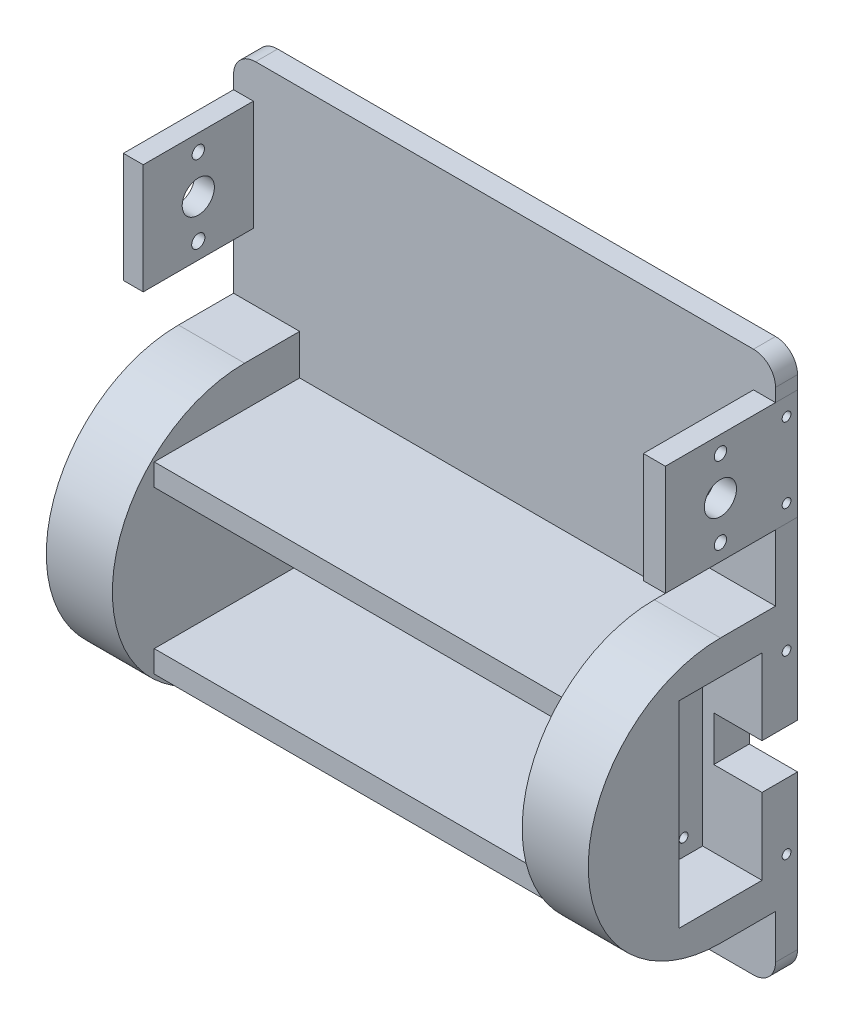
from build123d import *

# Parameters (mm, degrees)
RESSALTO_EXTRUS_O1_DEPTH      = 5
ESBO_O4_W                     = 4.495494134
ESBO_O4_H                     = 25
CORTE_EXTRUS_O2_DEPTH         = 5
RESSALTO_EXTRUS_O2_DEPTH      = 25
RESSALTO_EXTRUS_O2_DEPTH_BACK = 5
ESBO_O5_W                     = 4.495494134
ESBO_O5_H                     = 25
ESBO_O6_R                     = 1
CORTE_EXTRUS_O3_DEPTH         = 10
ESBO_O7_R                     = 1
CORTE_EXTRUS_O4_DEPTH         = 10
ESBO_O8_R                     = 3.65
CORTE_EXTRUS_O5_DEPTH         = 10
ESBO_O9_R                     = 1.4
CORTE_EXTRUS_O6_DEPTH         = 10
ESBO_O10_R                    = 1.5
CORTE_EXTRUS_O7_DEPTH         = 10
ESBO_O11_W                    = 5
ESBO_O11_H                    = 25
CORTE_EXTRUS_O8_DEPTH         = 10
RESSALTO_EXTRUS_O3_DEPTH      = 25
RESSALTO_EXTRUS_O3_DEPTH_BACK = 5
ESBO_O16_W                    = 5
ESBO_O16_H                    = 25
CORTE_EXTRUS_O9_START         = -10
ESBO_O17_R                    = 1
CORTE_EXTRUS_O9_DEPTH         = 10
CORTE_EXTRUS_O10_START        = -10
ESBO_O18_R                    = 1
CORTE_EXTRUS_O10_DEPTH        = 10
ESBO_O20_R                    = 3.65
CORTE_EXTRUS_O11_DEPTH        = 6
ESBO_O22_R                    = 1.4
CORTE_EXTRUS_O12_DEPTH        = 5
ESBO_O23_R                    = 1.4
CORTE_EXTRUS_O13_DEPTH        = 5
ESBO_O24_W                    = 15
ESBO_O24_H                    = 60
CORTE_EXTRUS_O14_DEPTH        = 10
ESBO_O27_W                    = 15
ESBO_O27_H                    = 60
CORTE_EXTRUS_O16_DEPTH        = 25
RESSALTO_EXTRUS_O7_DEPTH      = 12.5
RESSALTO_EXTRUS_O7_DEPTH_BACK = 5
ESBO_O32_W                    = 15
ESBO_O32_H                    = 60
RESSALTO_EXTRUS_O8_DEPTH      = 15
RESSALTO_EXTRUS_O9_DEPTH      = 12.5
RESSALTO_EXTRUS_O9_DEPTH_BACK = 5
ESBO_O34_W                    = 15
ESBO_O34_H                    = 60
RESSALTO_EXTRUS_O10_DEPTH     = 15
ESBO_O36_R                    = 1
CORTE_EXTRUS_O18_DEPTH        = 20
CORTE_EXTRUS_O19_START        = -20
ESBO_O37_R                    = 1
CORTE_EXTRUS_O19_DEPTH        = 20
ESBO_O39_W                    = 18.85
ESBO_O39_H                    = 44.705
CORTE_EXTRUS_O20_DEPTH        = 13.49
ESBO_O43_W                    = 10.95
ESBO_O43_H                    = 10.16
CORTE_EXTRUS_O23_DEPTH        = 10
ESBO_O44_W                    = 33
ESBO_O44_H                    = 5
RESSALTO_EXTRUS_O11_DEPTH     = 93
ESBO_O47_W                    = 33
ESBO_O47_H                    = 5
RESSALTO_EXTRUS_O12_DEPTH     = 93
ESBO_O41_R                    = 1.6255
ESBO_O41_R_2                  = 1
CORTE_EXTRUS_O25_DEPTH        = 31
ESBO_O42_R                    = 1.6255
ESBO_O42_R_2                  = 1
CORTE_EXTRUS_O26_DEPTH        = 31
ESBO_O52_W                    = 18.85
ESBO_O52_H                    = 44.705
CORTE_EXTRUS_O27_DEPTH        = 13.49
ESBO_O54_W                    = 10.951
ESBO_O54_H                    = 10.16
CORTE_EXTRUS_O28_DEPTH        = 24
ESBO_O55_R                    = 1.6255
ESBO_O55_R_2                  = 1
CORTE_EXTRUS_O29_DEPTH        = 31


with BuildPart() as part:
    # Esboço1 → Ressalto-extrusão1 (new body)
    with BuildSketch(Plane.XY):
        with BuildLine():
            Line((-47.810925728, 58.485502959), (65.189074272, 58.485502959))
            ThreePointArc((65.189074272, 58.485502959), (68.724608178, 57.021036865), (70.189074272, 53.485502959))
            Line((70.189074272, 53.485502959), (70.189074272, -59.514497041))
            ThreePointArc((70.189074272, -59.514497041), (68.724608178, -63.050030947), (65.189074272, -64.514497041))
            Line((65.189074272, -64.514497041), (-47.810925728, -64.514497041))
            ThreePointArc((-47.810925728, -64.514497041), (-51.346459634, -63.050030947), (-52.810925728, -59.514497041))
            Line((-52.810925728, -59.514497041), (-52.810925728, 53.485502959))
            ThreePointArc((-52.810925728, 53.485502959), (-51.346459634, 57.021036865), (-47.810925728, 58.485502959))
        make_face()
    extrude(amount=RESSALTO_EXTRUS_O1_DEPTH)

    # Esboço4 → Corte-extrusão2 (cut)
    with BuildSketch(Plane.XY.offset(5)):
        with Locations((-50.563178661, 37.985502959)):
            Rectangle(ESBO_O4_W, ESBO_O4_H)
    extrude(amount=-CORTE_EXTRUS_O2_DEPTH, mode=Mode.SUBTRACT)


with BuildPart() as body_2:
    # Esboço5 → Ressalto-extrusão2 (new, two sides: drawn at the far end of the back side and taken through both)
    with BuildSketch(Plane.XY.offset(5).offset(-RESSALTO_EXTRUS_O2_DEPTH_BACK)):
        with Locations((-50.563178661, 37.985502959)):
            Rectangle(ESBO_O5_W, ESBO_O5_H)
    extrude(amount=RESSALTO_EXTRUS_O2_DEPTH + RESSALTO_EXTRUS_O2_DEPTH_BACK)


with BuildPart() as corte_extrus_o3_tool:
    # Esboço6 → Corte-extrusão3 (new body)
    with BuildSketch(Plane.ZY.offset(52.810925728)):
        with Locations((2.5, 46.485502959)):
            Circle(ESBO_O6_R)
    extrude(amount=-CORTE_EXTRUS_O3_DEPTH)


with BuildPart() as part_1:
    add(part.part)

    # Corte-extrusão3: cut by corte_extrus_o3_tool
    add(corte_extrus_o3_tool.part, mode=Mode.SUBTRACT)


with BuildPart() as body_2_1:
    add(body_2.part)

    # Corte-extrusão3: cut by corte_extrus_o3_tool
    add(corte_extrus_o3_tool.part, mode=Mode.SUBTRACT)


with BuildPart() as corte_extrus_o4_tool:
    # Esboço7 → Corte-extrusão4 (new body)
    with BuildSketch(Plane.ZY.offset(52.810925728)):
        with Locations((2.5, 29.485502959)):
            Circle(ESBO_O7_R)
    extrude(amount=-CORTE_EXTRUS_O4_DEPTH)


with BuildPart() as part_2:
    add(part_1.part)

    # Corte-extrusão4: cut by corte_extrus_o4_tool
    add(corte_extrus_o4_tool.part, mode=Mode.SUBTRACT)

    # Esboço11 → Corte-extrusão8 (cut)
    with BuildSketch(Plane.XY.offset(5)):
        with Locations((67.689074272, 37.985502959)):
            Rectangle(ESBO_O11_W, ESBO_O11_H)
    extrude(amount=-CORTE_EXTRUS_O8_DEPTH, mode=Mode.SUBTRACT)


with BuildPart() as body_2_2:
    add(body_2_1.part)

    # Corte-extrusão4: cut by corte_extrus_o4_tool
    add(corte_extrus_o4_tool.part, mode=Mode.SUBTRACT)

    # Esboço8 → Corte-extrusão5 (cut)
    with BuildSketch(Plane(origin=(-48.315431594, 0, 0), x_dir=(0, 0, -1), z_dir=(1, 0, 0))):
        with Locations((-17.5, 37.985502959)):
            Circle(ESBO_O8_R)
    extrude(amount=-CORTE_EXTRUS_O5_DEPTH, mode=Mode.SUBTRACT)

    # Esboço9 → Corte-extrusão6 (cut)
    with BuildSketch(Plane.ZY.offset(52.810925728)):
        with Locations((17.5, 46.735502959)):
            Circle(ESBO_O9_R)
    extrude(amount=-CORTE_EXTRUS_O6_DEPTH, mode=Mode.SUBTRACT)

    # Esboço10 → Corte-extrusão7 (cut)
    with BuildSketch(Plane.ZY.offset(52.810925728)):
        with Locations((17.5, 29.235502959)):
            Circle(ESBO_O10_R)
    extrude(amount=-CORTE_EXTRUS_O7_DEPTH, mode=Mode.SUBTRACT)


with BuildPart() as body_3:
    # Esboço16 → Ressalto-extrusão3 (new, two sides: drawn at the far end of the back side and taken through both)
    with BuildSketch(Plane.XY.offset(5).offset(-RESSALTO_EXTRUS_O3_DEPTH_BACK)):
        with Locations((67.689074272, 37.985502959)):
            Rectangle(ESBO_O16_W, ESBO_O16_H)
    extrude(amount=RESSALTO_EXTRUS_O3_DEPTH + RESSALTO_EXTRUS_O3_DEPTH_BACK)


with BuildPart() as corte_extrus_o9_tool:
    # Esboço17 → Corte-extrusão9 (new body)
    with BuildSketch(Plane(origin=(70.189074272, 0, 0), x_dir=(0, 0, -1), z_dir=(1, 0, 0)).offset(CORTE_EXTRUS_O9_START)):
        with Locations((-2.5, 46.485502959)):
            Circle(ESBO_O17_R)
    extrude(amount=CORTE_EXTRUS_O9_DEPTH)


with BuildPart() as part_3:
    add(part_2.part)

    # Corte-extrusão9: cut by corte_extrus_o9_tool
    add(corte_extrus_o9_tool.part, mode=Mode.SUBTRACT)


with BuildPart() as body_3_1:
    add(body_3.part)

    # Corte-extrusão9: cut by corte_extrus_o9_tool
    add(corte_extrus_o9_tool.part, mode=Mode.SUBTRACT)


with BuildPart() as corte_extrus_o10_tool:
    # Esboço18 → Corte-extrusão10 (new body)
    with BuildSketch(Plane(origin=(70.189074272, 0, 0), x_dir=(0, 0, -1), z_dir=(1, 0, 0)).offset(CORTE_EXTRUS_O10_START)):
        with Locations((-2.5, 29.485502959)):
            Circle(ESBO_O18_R)
    extrude(amount=CORTE_EXTRUS_O10_DEPTH)


with BuildPart() as part_4:
    add(part_3.part)

    # Corte-extrusão10: cut by corte_extrus_o10_tool
    add(corte_extrus_o10_tool.part, mode=Mode.SUBTRACT)

    # Esboço24 → Corte-extrusão14 (cut)
    with BuildSketch(Plane.XY.offset(5)):
        with Locations((-45.310925728, -19.514497041)):
            Rectangle(ESBO_O24_W, ESBO_O24_H)
    extrude(amount=-CORTE_EXTRUS_O14_DEPTH, mode=Mode.SUBTRACT)

    # Esboço27 → Corte-extrusão16 (cut)
    with BuildSketch(Plane.XY.offset(5)):
        with Locations((62.689074272, -19.514497041)):
            Rectangle(ESBO_O27_W, ESBO_O27_H)
    extrude(amount=-CORTE_EXTRUS_O16_DEPTH, mode=Mode.SUBTRACT)


with BuildPart() as body_3_2:
    add(body_3_1.part)

    # Corte-extrusão10: cut by corte_extrus_o10_tool
    add(corte_extrus_o10_tool.part, mode=Mode.SUBTRACT)

    # Esboço20 → Corte-extrusão11 (cut)
    with BuildSketch(Plane(origin=(70.189074272, 0, 0), x_dir=(0, 0, -1), z_dir=(1, 0, 0))):
        with Locations((-17.5, 37.985502959)):
            Circle(ESBO_O20_R)
    extrude(amount=-CORTE_EXTRUS_O11_DEPTH, mode=Mode.SUBTRACT)

    # Esboço22 → Corte-extrusão12 (cut)
    with BuildSketch(Plane(origin=(70.189074272, 0, 0), x_dir=(0, 0, -1), z_dir=(1, 0, 0))):
        with Locations((-17.5, 46.735502959)):
            Circle(ESBO_O22_R)
    extrude(amount=-CORTE_EXTRUS_O12_DEPTH, mode=Mode.SUBTRACT)

    # Esboço23 → Corte-extrusão13 (cut)
    with BuildSketch(Plane(origin=(70.189074272, 0, 0), x_dir=(0, 0, -1), z_dir=(1, 0, 0))):
        with Locations((-17.5, 29.235502959)):
            Circle(ESBO_O23_R)
    extrude(amount=-CORTE_EXTRUS_O13_DEPTH, mode=Mode.SUBTRACT)


with BuildPart() as body_4:
    # Esboço32 → Ressalto-extrusão7 (new, two sides: drawn at the far end of the back side and taken through both)
    with BuildSketch(Plane.XY.offset(5).offset(-RESSALTO_EXTRUS_O7_DEPTH_BACK)):
        with Locations((-45.310925728, -19.514497041)):
            Rectangle(ESBO_O32_W, ESBO_O32_H)
    extrude(amount=RESSALTO_EXTRUS_O7_DEPTH + RESSALTO_EXTRUS_O7_DEPTH_BACK)


with BuildPart() as body_5:
    # Esboço33 → Ressalto-extrusão8 (new body)
    with BuildSketch(Plane.ZY.offset(52.810925728)):
        with BuildLine():
            Line((0, -49.514497041), (17.5, -49.514497041))
            ThreePointArc((17.5, -49.514497041), (47.5, -19.514497041), (17.5, 10.485502959))
            Line((17.5, 10.485502959), (0, 10.485502959))
            Line((0, 10.485502959), (0, -49.514497041))
        make_face()
    extrude(amount=-RESSALTO_EXTRUS_O8_DEPTH)


with BuildPart() as body_6:
    # Esboço34 → Ressalto-extrusão9 (new, two sides: drawn at the far end of the back side and taken through both)
    with BuildSketch(Plane.XY.offset(5).offset(-RESSALTO_EXTRUS_O9_DEPTH_BACK)):
        with Locations((62.689074272, -19.514497041)):
            Rectangle(ESBO_O34_W, ESBO_O34_H)
    extrude(amount=RESSALTO_EXTRUS_O9_DEPTH + RESSALTO_EXTRUS_O9_DEPTH_BACK)


with BuildPart() as body_7:
    # Esboço35 → Ressalto-extrusão10 (new body)
    with BuildSketch(Plane(origin=(70.189074272, 0, 0), x_dir=(0, 0, -1), z_dir=(1, 0, 0))):
        with BuildLine():
            Line((0, 10.485502959), (-17.5, 10.485502959))
            ThreePointArc((-17.5, 10.485502959), (-47.5, -19.514497041), (-17.5, -49.514497041))
            Line((-17.5, -49.514497041), (0, -49.514497041))
            Line((0, -49.514497041), (0, 10.485502959))
        make_face()
    extrude(amount=-RESSALTO_EXTRUS_O10_DEPTH)


with BuildPart() as corte_extrus_o18_tool:
    # Esboço36 → Corte-extrusão18 (new body)
    with BuildSketch(Plane(origin=(70.189074272, 0, 0), x_dir=(0, 0, -1), z_dir=(1, 0, 0))):
        with Locations((-2.5, -39.514497041)):
            Circle(ESBO_O36_R)
        with Locations((-2.5, 0.485502959)):
            Circle(ESBO_O36_R)
    extrude(amount=-CORTE_EXTRUS_O18_DEPTH)


with BuildPart() as part_5:
    add(part_4.part)

    # Corte-extrusão18: cut by corte_extrus_o18_tool
    add(corte_extrus_o18_tool.part, mode=Mode.SUBTRACT)


with BuildPart() as body_6_1:
    add(body_6.part)

    # Corte-extrusão18: cut by corte_extrus_o18_tool
    add(corte_extrus_o18_tool.part, mode=Mode.SUBTRACT)


with BuildPart() as body_7_1:
    add(body_7.part)

    # Corte-extrusão18: cut by corte_extrus_o18_tool
    add(corte_extrus_o18_tool.part, mode=Mode.SUBTRACT)


with BuildPart() as corte_extrus_o19_tool:
    # Esboço37 → Corte-extrusão19 (new body)
    with BuildSketch(Plane.ZY.offset(52.810925728).offset(CORTE_EXTRUS_O19_START)):
        with Locations((2.5, 0.485502959)):
            Circle(ESBO_O37_R)
        with Locations((2.5, -39.514497041)):
            Circle(ESBO_O37_R)
    extrude(amount=CORTE_EXTRUS_O19_DEPTH)


with BuildPart() as part_6:
    add(part_5.part)

    # Corte-extrusão19: cut by corte_extrus_o19_tool
    add(corte_extrus_o19_tool.part, mode=Mode.SUBTRACT)



with BuildPart() as body_4_1:
    add(body_4.part)

    # Corte-extrusão19: cut by corte_extrus_o19_tool
    add(corte_extrus_o19_tool.part, mode=Mode.SUBTRACT)


with BuildPart() as body_5_1:
    add(body_5.part)

    # Corte-extrusão19: cut by corte_extrus_o19_tool
    add(corte_extrus_o19_tool.part, mode=Mode.SUBTRACT)


with BuildPart() as corte_extrus_o20_tool:
    # Esboço39 → Corte-extrusão20 (new body)
    with BuildSketch(Plane(origin=(70.189074272, 0, 0), x_dir=(0, 0, -1), z_dir=(1, 0, 0))):
        with Locations((-17.491326567, -19.523544175)):
            Rectangle(ESBO_O39_W, ESBO_O39_H)
    extrude(amount=-CORTE_EXTRUS_O20_DEPTH)


with BuildPart() as body_6_2:
    add(body_6_1.part)

    # Corte-extrusão20: cut by corte_extrus_o20_tool
    add(corte_extrus_o20_tool.part, mode=Mode.SUBTRACT)


with BuildPart() as body_7_2:
    add(body_7_1.part)

    # Corte-extrusão20: cut by corte_extrus_o20_tool
    add(corte_extrus_o20_tool.part, mode=Mode.SUBTRACT)


with BuildPart() as corte_extrus_o23_tool:
    # Esboço43 → Corte-extrusão23 (new body)
    with BuildSketch(Plane.XY.offset(8.066326567)):
        with Locations((64.714074272, -19.514497041)):
            Rectangle(ESBO_O43_W, ESBO_O43_H)
    extrude(amount=-CORTE_EXTRUS_O23_DEPTH)


with BuildPart() as body_6_3:
    add(body_6_2.part)

    # Corte-extrusão23: cut by corte_extrus_o23_tool
    add(corte_extrus_o23_tool.part, mode=Mode.SUBTRACT)


with BuildPart() as body_7_3:
    add(body_7_2.part)

    # Corte-extrusão23: cut by corte_extrus_o23_tool
    add(corte_extrus_o23_tool.part, mode=Mode.SUBTRACT)


with BuildPart() as body_8:
    # Esboço44 → Ressalto-extrusão11 (new body)
    with BuildSketch(Plane.ZY.offset(-55.189074272)):
        with Locations((21.5, -1.169454191)):
            Rectangle(ESBO_O44_W, ESBO_O44_H)
    extrude(amount=RESSALTO_EXTRUS_O11_DEPTH)


with BuildPart() as part_7:
    add(part_6.part)

    add(body_4_1.part)  # Ressalto-extrusão12 merges body 4

    add(body_5_1.part)  # Ressalto-extrusão12 merges body 5

    add(body_6_3.part)  # Ressalto-extrusão12 merges body 6

    add(body_7_3.part)  # Ressalto-extrusão12 merges body 7
    # Esboço47 → Ressalto-extrusão12 (add)
    with BuildSketch(Plane.ZY.offset(-55.189074272)):
        with Locations((21.5, -37.864497041)):
            Rectangle(ESBO_O47_W, ESBO_O47_H)
    extrude(amount=RESSALTO_EXTRUS_O12_DEPTH)


with BuildPart() as corte_extrus_o25_tool:
    # Esboço41 → Corte-extrusão25 (new body)
    with BuildSketch(Plane(origin=(56.699074272, 0, 0), x_dir=(0, 0, -1), z_dir=(1, 0, 0))):
        with Locations((-20.375326567, -0.981044175)):
            Circle(ESBO_O41_R)
        with Locations((-12.375326567, -0.981044175)):
            Circle(ESBO_O41_R_2)
    extrude(amount=-CORTE_EXTRUS_O25_DEPTH)


with BuildPart() as part_8:
    add(part_7.part)

    # Corte-extrusão25: cut by corte_extrus_o25_tool
    add(corte_extrus_o25_tool.part, mode=Mode.SUBTRACT)

    # Esboço42 → Corte-extrusão26 (cut)
    with BuildSketch(Plane(origin=(56.699074272, 0, 0), x_dir=(0, 0, -1), z_dir=(1, 0, 0))):
        with Locations((-20.375326567, -38.066044175)):
            Circle(ESBO_O42_R)
        with Locations((-12.375326567, -38.066044175)):
            Circle(ESBO_O42_R_2)
    extrude(amount=-CORTE_EXTRUS_O26_DEPTH, mode=Mode.SUBTRACT)

    # Esboço52 → Corte-extrusão27 (cut)
    with BuildSketch(Plane.ZY.offset(52.810925728)):
        with Locations((20.248234245, -19.506997041)):
            Rectangle(ESBO_O52_W, ESBO_O52_H)
    extrude(amount=-CORTE_EXTRUS_O27_DEPTH, mode=Mode.SUBTRACT)

    # Esboço54 → Corte-extrusão28 (cut)
    with BuildSketch(Plane.XY.offset(10.823234245)):
        with Locations((-47.335425728, -19.514497041)):
            Rectangle(ESBO_O54_W, ESBO_O54_H)
    extrude(amount=-CORTE_EXTRUS_O28_DEPTH, mode=Mode.SUBTRACT)


with BuildPart() as body_8_1:
    add(body_8.part)

    # Corte-extrusão25: cut by corte_extrus_o25_tool
    add(corte_extrus_o25_tool.part, mode=Mode.SUBTRACT)


with BuildPart() as corte_extrus_o29_tool:
    # Esboço55 → Corte-extrusão29 (new body)
    with BuildSketch(Plane.ZY.offset(39.320925728)):
        with Locations((23.133234245, -0.964497041)):
            Circle(ESBO_O55_R)
        with Locations((23.133234245, -38.049497041)):
            Circle(ESBO_O55_R)
        with Locations((15.133234245, -0.964497041)):
            Circle(ESBO_O55_R_2)
        with Locations((15.133234245, -38.049497041)):
            Circle(ESBO_O55_R_2)
    extrude(amount=-CORTE_EXTRUS_O29_DEPTH)


with BuildPart() as part_9:
    add(part_8.part)

    # Corte-extrusão29: cut by corte_extrus_o29_tool
    add(corte_extrus_o29_tool.part, mode=Mode.SUBTRACT)


with BuildPart() as body_8_2:
    add(body_8_1.part)

    # Corte-extrusão29: cut by corte_extrus_o29_tool
    add(corte_extrus_o29_tool.part, mode=Mode.SUBTRACT)


solid = Compound([body_2_2.part, body_3_2.part, part_9.part, body_8_2.part])
